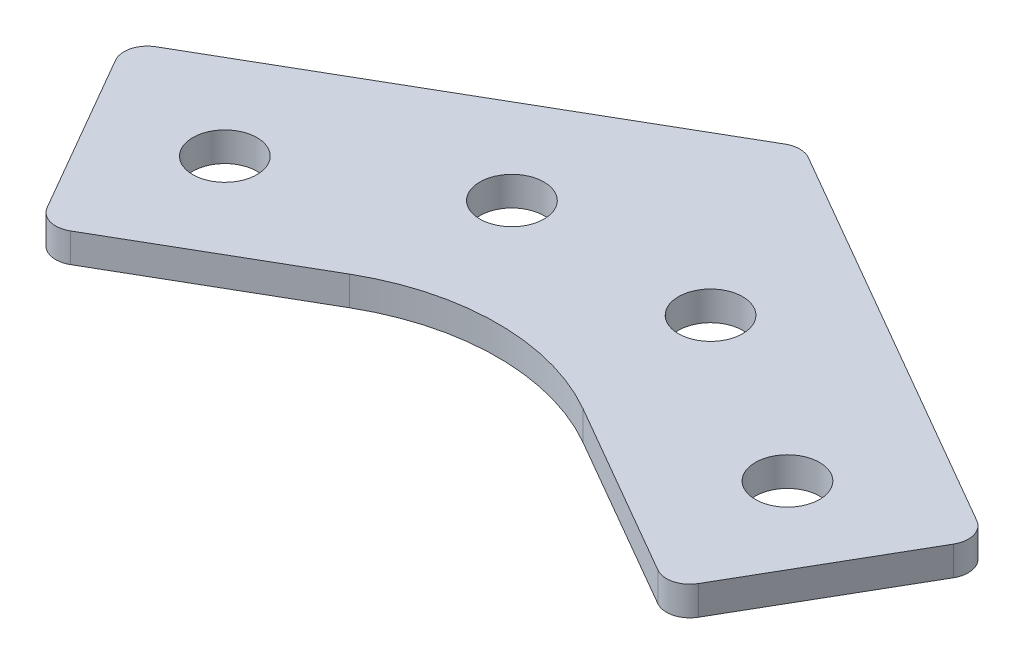
from build123d import *

# Parameters (mm, degrees)
BOSS_EXTRUDE1_DEPTH = 3.175
SKETCH2_R           = 3.4925
CUT_EXTRUDE2_DEPTH  = 3.175
LPATTERN5_COUNT     = 2
LPATTERN5_PITCH     = 22.86
SKETCH7_R           = 3.4925
CUT_EXTRUDE3_DEPTH  = 3.175
LPATTERN6_COUNT     = 2
LPATTERN6_PITCH     = 22.86
FILLET1_R           = 2.54
FILLET2_R           = 25.4


with BuildPart() as part:
    # Sketch1 → Boss-Extrude1 (new body)
    with BuildSketch(Plane(origin=(0, 0, 0), x_dir=(1, 0, 0), z_dir=(0, 1, 0))):
        Polygon((-25.4, 14.664696837), (0, 29.329393675), (25.4, 14.664696837), (46.85041276, 2.280295256), (34.15041276, -19.71675), (0, 0), (-34.15041276, -19.71675), (-46.85041276, 2.280295256), align=None)
    extrude(amount=BOSS_EXTRUDE1_DEPTH)

    # Sketch2 → Cut-Extrude2 (cut)
    with BuildSketch(Plane(origin=(0, 3.175, 0), x_dir=(1, 0, 0), z_dir=(0, 1, 0))):
        with Locations((-30.601742395, -3.003227372)):
            Circle(SKETCH2_R)
    cut_extrude2 = extrude(amount=-CUT_EXTRUDE2_DEPTH, mode=Mode.SUBTRACT)

    # LPattern5: Cut-Extrude2 ×2
    with Locations(*[Vector(0.8660254037844386, 0, -0.5000000000000003) * (i * LPATTERN5_PITCH) for i in range(1, LPATTERN5_COUNT)]):
        add(cut_extrude2, mode=Mode.SUBTRACT)

    # Sketch7 → Cut-Extrude3 (cut)
    with BuildSketch(Plane(origin=(0, 3.175, 0), x_dir=(1, 0, 0), z_dir=(0, 1, 0))):
        with Locations((30.601742395, -3.003227372)):
            Circle(SKETCH7_R)
    cut_extrude3 = extrude(amount=-CUT_EXTRUDE3_DEPTH, mode=Mode.SUBTRACT)

    # LPattern6: Cut-Extrude3 ×2
    with Locations(*[Vector(-0.8660254037844375, 0, -0.5000000000000022) * (i * LPATTERN6_PITCH) for i in range(1, LPATTERN6_COUNT)]):
        add(cut_extrude3, mode=Mode.SUBTRACT)

    # Fillet1
    fillet1_edges = [part.edges().sort_by_distance(p)[0] for p in [
        (0, 1.5875, -29.329393675),
        (46.85041276, 1.5875, -2.280295256),
        (34.15041276, 1.5875, 19.71675),
        (-46.85041276, 1.5875, -2.280295256),
        (-34.15041276, 1.5875, 19.71675),
    ]]
    fillet(fillet1_edges, radius=FILLET1_R)

    # Fillet2
    fillet2_edges = [part.edges().sort_by_distance(p)[0] for p in [
        (0, 1.5875, 0),
    ]]
    fillet(fillet2_edges, radius=FILLET2_R)


solid = part.part
